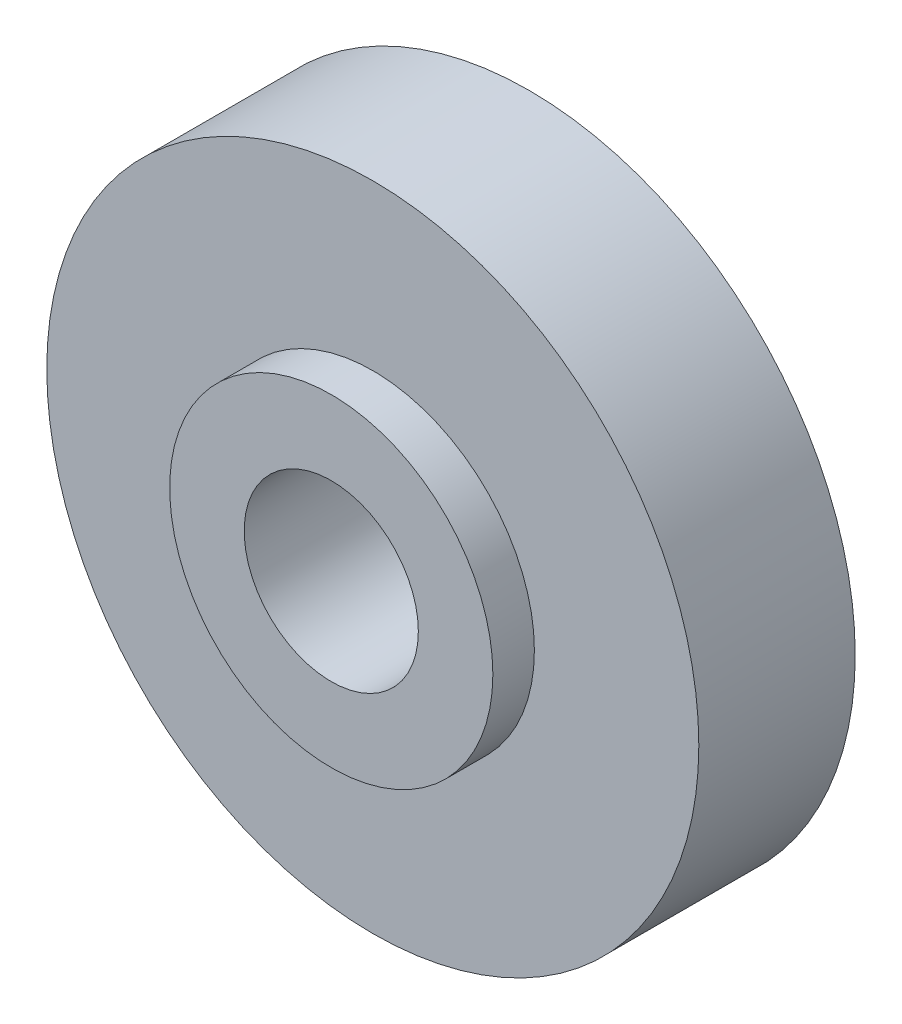
from build123d import *

# Parameters (mm, degrees)
SKETCH1_R           = 24.7269
SKETCH1_R_2         = 12.2555
BOSS_EXTRUDE1_DEPTH = 5.9309
SKETCH1_3_R         = 12.2555
SKETCH1_3_R_2       = 6.604
BOSS_EXTRUDE2_DEPTH = 9.0805


with BuildPart() as part:
    # Sketch1 → Boss-Extrude1 (new, symmetric)
    with BuildSketch(Plane.XY):
        Circle(SKETCH1_R)
        Circle(SKETCH1_R_2, mode=Mode.SUBTRACT)
    extrude(amount=BOSS_EXTRUDE1_DEPTH, both=True)


with BuildPart() as body_2:
    # Sketch1<3> → Boss-Extrude2 (new, symmetric)
    with BuildSketch(Plane.XY):
        Circle(SKETCH1_3_R)
        Circle(SKETCH1_3_R_2, mode=Mode.SUBTRACT)
    extrude(amount=BOSS_EXTRUDE2_DEPTH, both=True)


solid = Compound([part.part, body_2.part])
